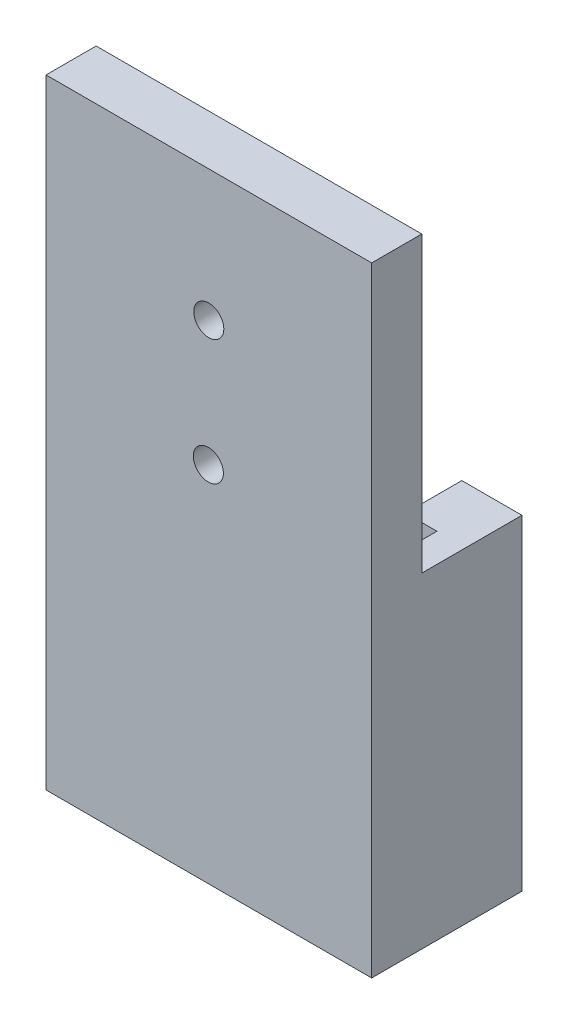
from build123d import *

# Parameters (mm, degrees)
ESQUISSE1_W             = 15.712671493
ESQUISSE1_H             = 32.57240809
ESQUISSE1_R             = 1.2
BOSS_EXTRU_1_DEPTH      = 4
BOSS_EXTRU_2_DEPTH      = 10
BOSS_EXTRU_2_DEPTH_BACK = 16
BOSS_EXTRU_4_DEPTH      = 4


with BuildPart() as part:
    # Esquisse1 → Boss.-Extru.1 (new body)
    with BuildSketch(Plane.XY):
        with Locations((7.856335747, 16.286204045)):
            Rectangle(ESQUISSE1_W, ESQUISSE1_H)
        with Locations((7.85, 28.978207996)):
            Circle(ESQUISSE1_R, mode=Mode.SUBTRACT)
        with Locations((7.814879524, 18.978269669)):
            Circle(ESQUISSE1_R, mode=Mode.SUBTRACT)
    extrude(amount=BOSS_EXTRU_1_DEPTH)

    # Esquisse2 → Boss.-Extru.2 (add, two sides: drawn at the far end of the back side and taken through both)
    with BuildSketch(Plane.XZ.offset(-BOSS_EXTRU_2_DEPTH_BACK)):
        Polygon((-5.143664254, 4), (20.856335746, 4), (20.856335746, -8), (16.056335746, -8), (16.056335746, -3.5), (18.56763753, -3.5), (18.56763753, -0.5), (15.713373902, -0.5), (15.712671493, 0), (0, 0), (-0.00070241, -0.5), (-2.854966038, -0.5), (-2.854966038, -3.5), (-0.343664254, -3.5), (-0.343664254, -8), (-5.143664254, -8), align=None)
    extrude(amount=BOSS_EXTRU_2_DEPTH + BOSS_EXTRU_2_DEPTH_BACK)

    # Esquisse4 → Boss.-Extru.4 (add)
    with BuildSketch(Plane.XY.offset(4)):
        Polygon((0, 16), (-5.143664254, 16), (-5.143664254, 39.452985167), (20.856335746, 39.452985167), (20.856335746, 16), (15.712671493, 16), (14.344424764, 16), (14.344424764, 31.44629888), (1.552132881, 31.44629888), (1.552132881, 16), align=None)
    extrude(amount=-BOSS_EXTRU_4_DEPTH)


solid = part.part
